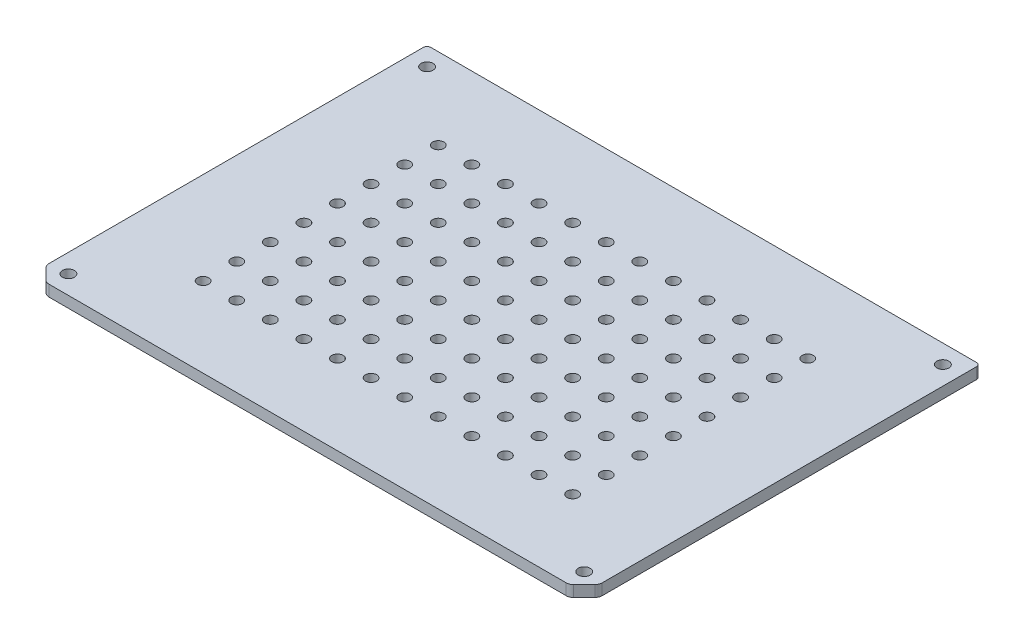
from build123d import *

# Parameters (mm, degrees)
SKETCH1_W            = 148.2
SKETCH1_H            = 106.1
SKETCH1_R            = 1.6
BOSS_EXTRUDE1_DEPTH  = 3
SKETCH2_R            = 1.5
CUT_EXTRUDE1_DEPTH   = 3
LPATTERN1_COUNT      = 8
LPATTERN1_PITCH      = 9
LPATTERN1_COUNT_DIR2 = 12
LPATTERN1_PITCH_DIR2 = 9
FILLET1_R            = 1
CUT_EXTRUDE2_DEPTH   = 3
FILLET2_R            = 2


with BuildPart() as part:
    # Sketch1 → Boss-Extrude1 (new body)
    with BuildSketch(Plane(origin=(0, 0, 0), x_dir=(1, 0, 0), z_dir=(0, 1, 0))):
        Rectangle(SKETCH1_W, SKETCH1_H)
        with Locations(Location((-69.1, 48.05, 0), (0, 0, 270))):
            Circle(SKETCH1_R, mode=Mode.SUBTRACT)
        with Locations(Location((-69.1, -48.05, 0), (0, 0, 90))):
            Circle(SKETCH1_R, mode=Mode.SUBTRACT)
        with Locations(Location((69.1, -48.05, 0), (0, 0, 270))):
            Circle(SKETCH1_R, mode=Mode.SUBTRACT)
        with Locations(Location((69.1, 48.05, 0), (0, 0, 90))):
            Circle(SKETCH1_R, mode=Mode.SUBTRACT)
    extrude(amount=BOSS_EXTRUDE1_DEPTH)

    # Sketch2 → Cut-Extrude1 (cut)
    with BuildSketch(Plane(origin=(0, 3, 0), x_dir=(-1, 0, 0), z_dir=(0, 1, 0))):
        with Locations(Location((49.4, -31.35, 0), (0, 0, 90))):
            Circle(SKETCH2_R)
    cut_extrude1 = extrude(amount=-CUT_EXTRUDE1_DEPTH, mode=Mode.SUBTRACT)

    # LPattern1: Cut-Extrude1 8 × 12
    with Locations(*[(j * LPATTERN1_PITCH_DIR2, 0, i * LPATTERN1_PITCH) for i in range(LPATTERN1_COUNT) for j in range(LPATTERN1_COUNT_DIR2) if (i, j) != (0, 0)]):
        add(cut_extrude1, mode=Mode.SUBTRACT)

    # Fillet1
    fillet1_edges = [part.edges().sort_by_distance(p)[0] for p in [
        (-74.1, 1.5, -53.05),
        (74.1, 1.5, -53.05),
        (74.1, 1.5, 53.05),
        (-74.1, 1.5, 53.05),
    ]]
    fillet(fillet1_edges, radius=FILLET1_R)

    # Sketch3 → Cut-Extrude2 (cut)
    with BuildSketch(Plane(origin=(0, 3, 0), x_dir=(-1, 0, 0), z_dir=(0, 1, 0))):
        Polygon((77.1, 46.05), (67.1, 56.05), (77.1, 56.05), align=None)
        Polygon((-77.1, 56.05), (-77.1, 46.05), (-67.1, 56.05), align=None)
    extrude(amount=-CUT_EXTRUDE2_DEPTH, mode=Mode.SUBTRACT)

    # Fillet2
    fillet2_edges = [part.edges().sort_by_distance(p)[0] for p in [
        (-70.1, 1.5, 53.05),
        (-74.1, 1.5, 49.05),
        (74.1, 1.5, 49.05),
        (70.1, 1.5, 53.05),
    ]]
    fillet(fillet2_edges, radius=FILLET2_R)


solid = part.part
